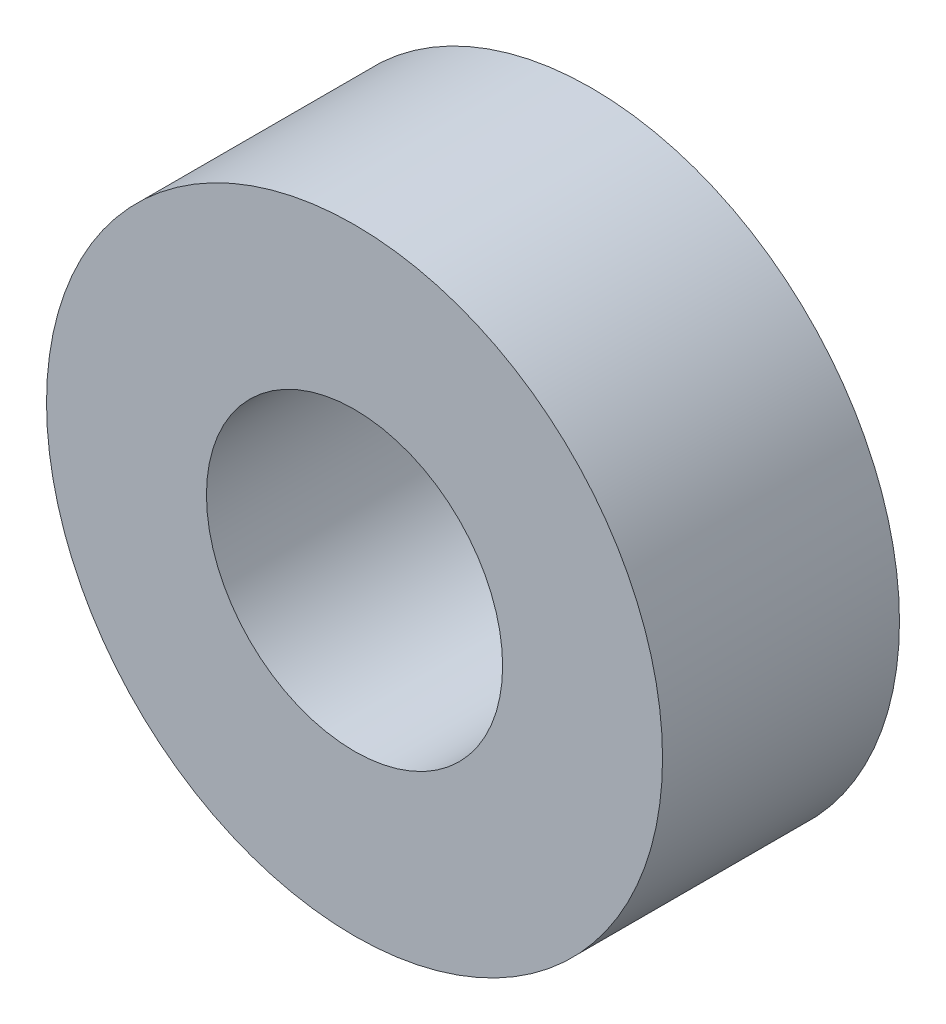
from build123d import *

# Parameters (mm, degrees)
ESQUISSE1_R        = 13
ESQUISSE1_R_2      = 6.25
BOSS_EXTRU_1_DEPTH = 10


with BuildPart() as part:
    # Esquisse1 → Boss.-Extru.1 (new body)
    with BuildSketch(Plane.XY):
        Circle(ESQUISSE1_R)
        Circle(ESQUISSE1_R_2, mode=Mode.SUBTRACT)
    extrude(amount=BOSS_EXTRU_1_DEPTH)


solid = part.part
